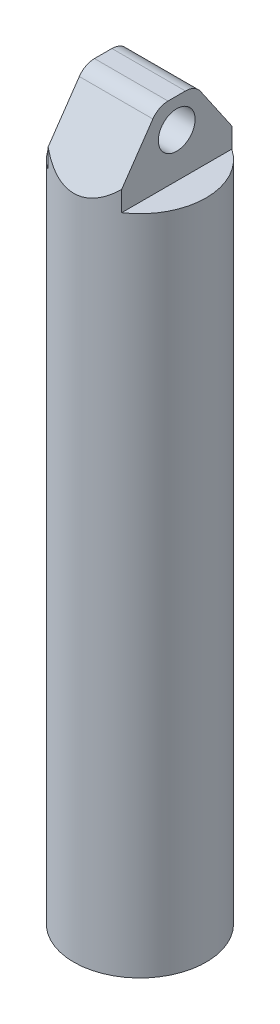
from build123d import *

# Parameters (mm, degrees)
CROQUIS1_R                   = 18
SALIENTE_EXTRUIR1_DEPTH      = 180
VACIADO1_T                   = -1
CROQUIS3_R                   = 17
CROQUIS3_R_2                 = 10
SALIENTE_EXTRUIR2_DEPTH      = 5
SALIENTE_EXTRUIR3_DEPTH      = 10
SALIENTE_EXTRUIR3_DEPTH_BACK = 10
CROQUIS4_R                   = 5
CORTAR_EXTRUIR1_DEPTH        = 37


with BuildPart() as part:
    # Croquis1 → Saliente-Extruir1 (new body)
    with BuildSketch(Plane(origin=(0, 0, 0), x_dir=(1, 0, 0), z_dir=(0, 1, 0))):
        Circle(CROQUIS1_R)
    extrude(amount=SALIENTE_EXTRUIR1_DEPTH)

    # Vaciado1
    vaciado1_openings = [part.faces().sort_by_distance(p)[0] for p in [
        (0, 0, 0),
    ]]
    offset(amount=VACIADO1_T, openings=vaciado1_openings, kind=Kind.INTERSECTION)

    # Croquis3 → Saliente-Extruir2 (add)
    with BuildSketch(Plane.XZ):
        Circle(CROQUIS3_R)
        Circle(CROQUIS3_R_2, mode=Mode.SUBTRACT)
    extrude(amount=-SALIENTE_EXTRUIR2_DEPTH)

    # Croquis4 → Saliente-Extruir3 (add, two sides: drawn at the far end of the back side and taken through both)
    with BuildSketch(Plane(origin=(0, 0, 0), x_dir=(0, 0, -1), z_dir=(1, 0, 0)).offset(-SALIENTE_EXTRUIR3_DEPTH_BACK)):
        with BuildLine():
            Line((-2.367587924, 200), (2.367587924, 200))
            ThreePointArc((2.367587924, 200), (4.696897355, 199.424287239), (6.489801521, 197.82972703))
            Line((6.489801521, 197.82972703), (18.729162566, 180))
            Line((18.729162566, 180), (-18.729162566, 180))
            Line((-18.729162566, 180), (-6.489801521, 197.82972703))
            ThreePointArc((-6.489801521, 197.82972703), (-4.696897355, 199.424287239), (-2.367587924, 200))
        make_face()
        with Locations((0, 192)):
            Circle(CROQUIS4_R, mode=Mode.SUBTRACT)
    extrude(amount=SALIENTE_EXTRUIR3_DEPTH + SALIENTE_EXTRUIR3_DEPTH_BACK)

    # Croquis5 → Cortar-Extruir1 (cut)
    with BuildSketch(Plane(origin=(0, 180, 0), x_dir=(1, 0, 0), z_dir=(0, 1, 0))):
        with BuildLine():
            Line((34.507590677, -30.013991489), (34.507590677, -14.966629547))
            Line((34.507590677, -14.966629547), (10, -14.966629547))
            ThreePointArc((10, -14.966629547), (-18, 0), (10, 14.966629547))
            Line((10, 14.966629547), (10, 20.876886583))
            Line((10, 20.876886583), (-23.183234279, 20.876886583))
            Line((-23.183234279, 20.876886583), (-23.183234279, -30.013991489))
            Line((-23.183234279, -30.013991489), (34.507590677, -30.013991489))
        make_face()
    extrude(amount=CORTAR_EXTRUIR1_DEPTH, mode=Mode.SUBTRACT)


solid = part.part
